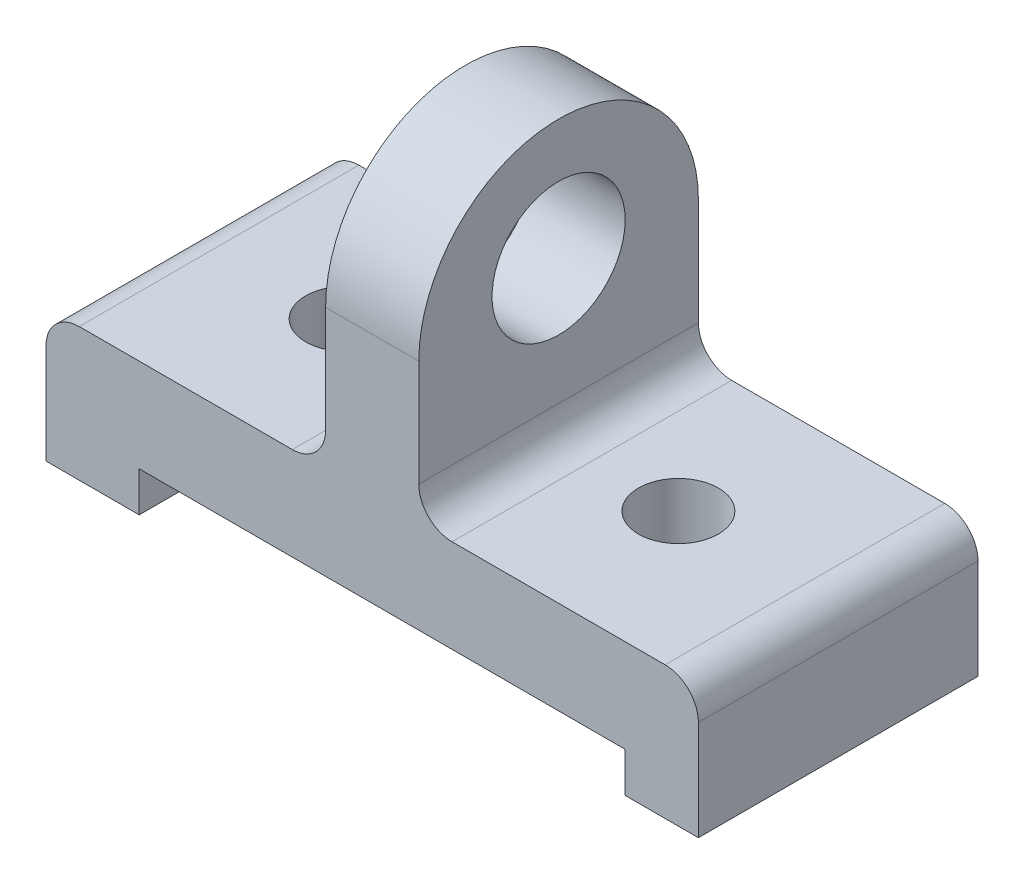
from build123d import *

# Parameters (mm, degrees)
SKETCH1_W                = 98
SKETCH1_H                = 42
BOSS_EXTRUDE1_DEPTH      = 14
BOSS_EXTRUDE2_DEPTH      = 21
BOSS_EXTRUDE2_DEPTH_BACK = 21
SKETCH2_W                = 11.017552575
SKETCH2_H                = 6
FILLET1_R                = 5
SKETCH3_W                = 14
SKETCH3_H                = 6
BOSS_EXTRUDE3_DEPTH      = 42
FILLET2_R                = 5
SKETCH4_R                = 6
CUT_EXTRUDE1_DEPTH       = 14
BOSS_EXTRUDE4_DEPTH      = 7
BOSS_EXTRUDE4_DEPTH_BACK = 7
SKETCH5_R                = 10
FILLET3_R                = 5
FILLET4_R                = 5


with BuildPart() as part:
    # Sketch1 → Boss-Extrude1 (new body)
    with BuildSketch(Plane(origin=(0, 0, 0), x_dir=(1, 0, 0), z_dir=(0, 1, 0))):
        Rectangle(SKETCH1_W, SKETCH1_H)
    extrude(amount=BOSS_EXTRUDE1_DEPTH)

    # Sketch2 → Boss-Extrude2 (add, two sides: drawn at the far end of the back side and taken through both)
    with BuildSketch(Plane.XY.offset(-BOSS_EXTRUDE2_DEPTH_BACK)):
        with Locations((43.491223713, -3)):
            Rectangle(SKETCH2_W, SKETCH2_H)
    extrude(amount=BOSS_EXTRUDE2_DEPTH + BOSS_EXTRUDE2_DEPTH_BACK)

    # Fillet1
    fillet1_edges = [part.edges().sort_by_distance(p)[0] for p in [
        (49, 14, 0),
    ]]
    fillet(fillet1_edges, radius=FILLET1_R)

    # Sketch3 → Boss-Extrude3 (add)
    with BuildSketch(Plane.XY.offset(21)):
        with Locations((-42, -3)):
            Rectangle(SKETCH3_W, SKETCH3_H)
    extrude(amount=-BOSS_EXTRUDE3_DEPTH)

    # Fillet2
    fillet2_edges = [part.edges().sort_by_distance(p)[0] for p in [
        (-49, 14, 0),
    ]]
    fillet(fillet2_edges, radius=FILLET2_R)

    # Sketch4 → Cut-Extrude1 (cut)
    with BuildSketch(Plane(origin=(0, 0, 0), x_dir=(1, 0, 0), z_dir=(0, 1, 0))):
        with Locations((25, 0)):
            Circle(SKETCH4_R)
        with Locations((-25, 0)):
            Circle(SKETCH4_R)
    extrude(amount=CUT_EXTRUDE1_DEPTH, mode=Mode.SUBTRACT)

    # Sketch5 → Boss-Extrude4 (add, two sides: drawn at the far end of the back side and taken through both)
    with BuildSketch(Plane(origin=(0, 0, 0), x_dir=(0, 0, -1), z_dir=(1, 0, 0)).offset(-BOSS_EXTRUDE4_DEPTH_BACK)):
        with BuildLine():
            Line((-21, 14), (-21, 35))
            ThreePointArc((-21, 35), (0, 56), (21, 35))
            Line((21, 35), (21, 14))
            Line((21, 14), (-21, 14))
        make_face()
        with Locations((0, 37.895751368)):
            Circle(SKETCH5_R, mode=Mode.SUBTRACT)
    extrude(amount=BOSS_EXTRUDE4_DEPTH + BOSS_EXTRUDE4_DEPTH_BACK)

    # Fillet3
    fillet3_edges = [part.edges().sort_by_distance(p)[0] for p in [
        (7, 14, 0),
    ]]
    fillet(fillet3_edges, radius=FILLET3_R)

    # Fillet4
    fillet4_edges = [part.edges().sort_by_distance(p)[0] for p in [
        (-7, 14, 0),
    ]]
    fillet(fillet4_edges, radius=FILLET4_R)


solid = part.part
